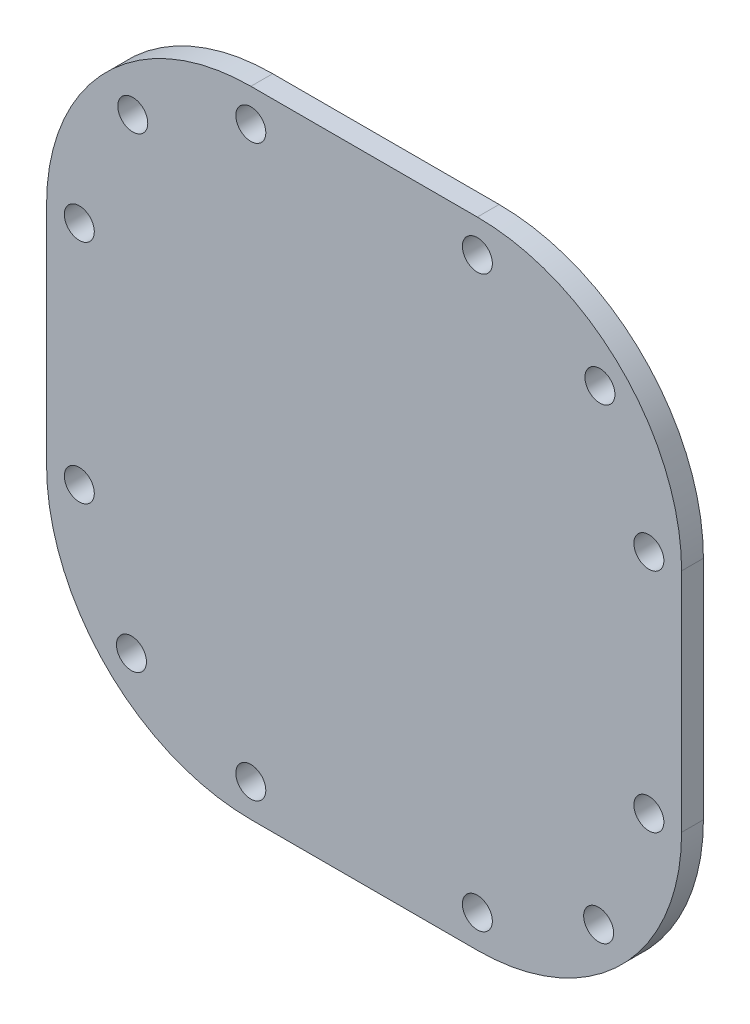
from build123d import *

# Parameters (mm, degrees)
BOSS_EXTRUDE1_DEPTH = 3.175
CUT_EXTRUDE2_REACH  = 69.068
SKETCH3_R           = 2.1828125
SKETCH4_W           = 109.59125296
SKETCH4_H           = 128.097404578
CUT_EXTRUDE3_DEPTH  = 68.067905193


with BuildPart() as part:
    # Sketch1 → Boss-Extrude1 (new body)
    with BuildSketch(Plane.XY):
        with BuildLine():
            Line((46.57725, -47.371), (-46.57725, -47.371))
            ThreePointArc((-46.57725, -47.371), (-47.138516008, -47.138516008), (-47.371, -46.57725))
            Line((-47.371, -46.57725), (-47.371, 46.57725))
            ThreePointArc((-47.371, 46.57725), (-47.138516008, 47.138516008), (-46.57725, 47.371))
            Line((-46.57725, 47.371), (46.57725, 47.371))
            ThreePointArc((46.57725, 47.371), (47.138516008, 47.138516008), (47.371, 46.57725))
            Line((47.371, 46.57725), (47.371, -46.57725))
            ThreePointArc((47.371, -46.57725), (47.138516008, -47.138516008), (46.57725, -47.371))
        make_face()
    extrude(amount=BOSS_EXTRUDE1_DEPTH)

    # Sketch3 → Cut-Extrude2 (cut, up to next)
    with BuildSketch(Plane.XY.offset(3.175), mode=Mode.PRIVATE) as cut_extrude2_sk1:
        with Locations((16.490011722, -41.462970183)):
            Circle(SKETCH3_R)
    cut_extrude2_tool1 = extrude(cut_extrude2_sk1.sketch, amount=-CUT_EXTRUDE2_REACH, mode=Mode.PRIVATE) & part.part
    # Sketch3 → Cut-Extrude2 (cut, up to next)
    with BuildSketch(Plane.XY.offset(3.175), mode=Mode.PRIVATE) as cut_extrude2_sk2:
        with Locations((34.1474239, -34.1474239)):
            Circle(SKETCH3_R)
    cut_extrude2_tool2 = extrude(cut_extrude2_sk2.sketch, amount=-CUT_EXTRUDE2_REACH, mode=Mode.PRIVATE) & part.part
    # Sketch3 → Cut-Extrude2 (cut, up to next)
    with BuildSketch(Plane.XY.offset(3.175), mode=Mode.PRIVATE) as cut_extrude2_sk3:
        with Locations((41.460741539, -16.494469011)):
            Circle(SKETCH3_R)
    cut_extrude2_tool3 = extrude(cut_extrude2_sk3.sketch, amount=-CUT_EXTRUDE2_REACH, mode=Mode.PRIVATE) & part.part
    # Sketch3 → Cut-Extrude2 (cut, up to next)
    with BuildSketch(Plane.XY.offset(3.175), mode=Mode.PRIVATE) as cut_extrude2_sk4:
        with Locations((41.460741539, 16.490011722)):
            Circle(SKETCH3_R)
    cut_extrude2_tool4 = extrude(cut_extrude2_sk4.sketch, amount=-CUT_EXTRUDE2_REACH, mode=Mode.PRIVATE) & part.part
    # Sketch3 → Cut-Extrude2 (cut, up to next)
    with BuildSketch(Plane.XY.offset(3.175), mode=Mode.PRIVATE) as cut_extrude2_sk5:
        with Locations((34.335639739, 33.869270843)):
            Circle(SKETCH3_R)
    cut_extrude2_tool5 = extrude(cut_extrude2_sk5.sketch, amount=-CUT_EXTRUDE2_REACH, mode=Mode.PRIVATE) & part.part
    # Sketch3 → Cut-Extrude2 (cut, up to next)
    with BuildSketch(Plane.XY.offset(3.175), mode=Mode.PRIVATE) as cut_extrude2_sk6:
        with Locations((16.492240366, 41.460741539)):
            Circle(SKETCH3_R)
    cut_extrude2_tool6 = extrude(cut_extrude2_sk6.sketch, amount=-CUT_EXTRUDE2_REACH, mode=Mode.PRIVATE) & part.part
    # Sketch3 → Cut-Extrude2 (cut, up to next)
    with BuildSketch(Plane.XY.offset(3.175), mode=Mode.PRIVATE) as cut_extrude2_sk7:
        with Locations((-16.492240366, 41.460741539)):
            Circle(SKETCH3_R)
    cut_extrude2_tool7 = extrude(cut_extrude2_sk7.sketch, amount=-CUT_EXTRUDE2_REACH, mode=Mode.PRIVATE) & part.part
    # Sketch3 → Cut-Extrude2 (cut, up to next)
    with BuildSketch(Plane.XY.offset(3.175), mode=Mode.PRIVATE) as cut_extrude2_sk8:
        with Locations((-33.681055005, 34.057486682)):
            Circle(SKETCH3_R)
    cut_extrude2_tool8 = extrude(cut_extrude2_sk8.sketch, amount=-CUT_EXTRUDE2_REACH, mode=Mode.PRIVATE) & part.part
    # Sketch3 → Cut-Extrude2 (cut, up to next)
    with BuildSketch(Plane.XY.offset(3.175), mode=Mode.PRIVATE) as cut_extrude2_sk9:
        with Locations((-41.462970183, 16.492240366)):
            Circle(SKETCH3_R)
    cut_extrude2_tool9 = extrude(cut_extrude2_sk9.sketch, amount=-CUT_EXTRUDE2_REACH, mode=Mode.PRIVATE) & part.part
    # Sketch3 → Cut-Extrude2 (cut, up to next)
    with BuildSketch(Plane.XY.offset(3.175), mode=Mode.PRIVATE) as cut_extrude2_sk10:
        with Locations((-41.462970183, -16.492240366)):
            Circle(SKETCH3_R)
    cut_extrude2_tool10 = extrude(cut_extrude2_sk10.sketch, amount=-CUT_EXTRUDE2_REACH, mode=Mode.PRIVATE) & part.part
    # Sketch3 → Cut-Extrude2 (cut, up to next)
    with BuildSketch(Plane.XY.offset(3.175), mode=Mode.PRIVATE) as cut_extrude2_sk11:
        with Locations((-16.494469011, -41.462970183)):
            Circle(SKETCH3_R)
    cut_extrude2_tool11 = extrude(cut_extrude2_sk11.sketch, amount=-CUT_EXTRUDE2_REACH, mode=Mode.PRIVATE) & part.part
    # Sketch3 → Cut-Extrude2 (cut, up to next)
    with BuildSketch(Plane.XY.offset(3.175), mode=Mode.PRIVATE) as cut_extrude2_sk12:
        with Locations((-33.869270843, -33.959208062)):
            Circle(SKETCH3_R)
    cut_extrude2_tool12 = extrude(cut_extrude2_sk12.sketch, amount=-CUT_EXTRUDE2_REACH, mode=Mode.PRIVATE) & part.part
    add(cut_extrude2_tool1.solids().sort_by_distance((16.490012, -41.46297, 3.175))[0], mode=Mode.SUBTRACT)
    add(cut_extrude2_tool2.solids().sort_by_distance((34.147424, -34.147424, 3.175))[0], mode=Mode.SUBTRACT)
    add(cut_extrude2_tool3.solids().sort_by_distance((41.460742, -16.494469, 3.175))[0], mode=Mode.SUBTRACT)
    add(cut_extrude2_tool4.solids().sort_by_distance((41.460742, 16.490012, 3.175))[0], mode=Mode.SUBTRACT)
    add(cut_extrude2_tool5.solids().sort_by_distance((34.33564, 33.869271, 3.175))[0], mode=Mode.SUBTRACT)
    add(cut_extrude2_tool6.solids().sort_by_distance((16.49224, 41.460742, 3.175))[0], mode=Mode.SUBTRACT)
    add(cut_extrude2_tool7.solids().sort_by_distance((-16.49224, 41.460742, 3.175))[0], mode=Mode.SUBTRACT)
    add(cut_extrude2_tool8.solids().sort_by_distance((-33.681055, 34.057487, 3.175))[0], mode=Mode.SUBTRACT)
    add(cut_extrude2_tool9.solids().sort_by_distance((-41.46297, 16.49224, 3.175))[0], mode=Mode.SUBTRACT)
    add(cut_extrude2_tool10.solids().sort_by_distance((-41.46297, -16.49224, 3.175))[0], mode=Mode.SUBTRACT)
    add(cut_extrude2_tool11.solids().sort_by_distance((-16.494469, -41.46297, 3.175))[0], mode=Mode.SUBTRACT)
    add(cut_extrude2_tool12.solids().sort_by_distance((-33.869271, -33.959208, 3.175))[0], mode=Mode.SUBTRACT)

    # Sketch4 → Cut-Extrude3 (cut, through all)
    with BuildSketch(Plane.XY.offset(3.175)):
        Rectangle(SKETCH4_W, SKETCH4_H)
        with BuildLine():
            Line((16.4846, -46.228), (-16.4846, -46.228))
            ThreePointArc((-16.4846, -46.228), (-37.516359836, -37.516359836), (-46.228, -16.4846))
            Line((-46.228, -16.4846), (-46.228, 16.4846))
            ThreePointArc((-46.228, 16.4846), (-37.516359836, 37.516359836), (-16.4846, 46.228))
            Line((-16.4846, 46.228), (16.4846, 46.228))
            ThreePointArc((16.4846, 46.228), (37.516359836, 37.516359836), (46.228, 16.4846))
            Line((46.228, 16.4846), (46.228, -16.4846))
            ThreePointArc((46.228, -16.4846), (37.516359836, -37.516359836), (16.4846, -46.228))
        make_face(mode=Mode.SUBTRACT)
    extrude(amount=-CUT_EXTRUDE3_DEPTH, mode=Mode.SUBTRACT)


solid = part.part
